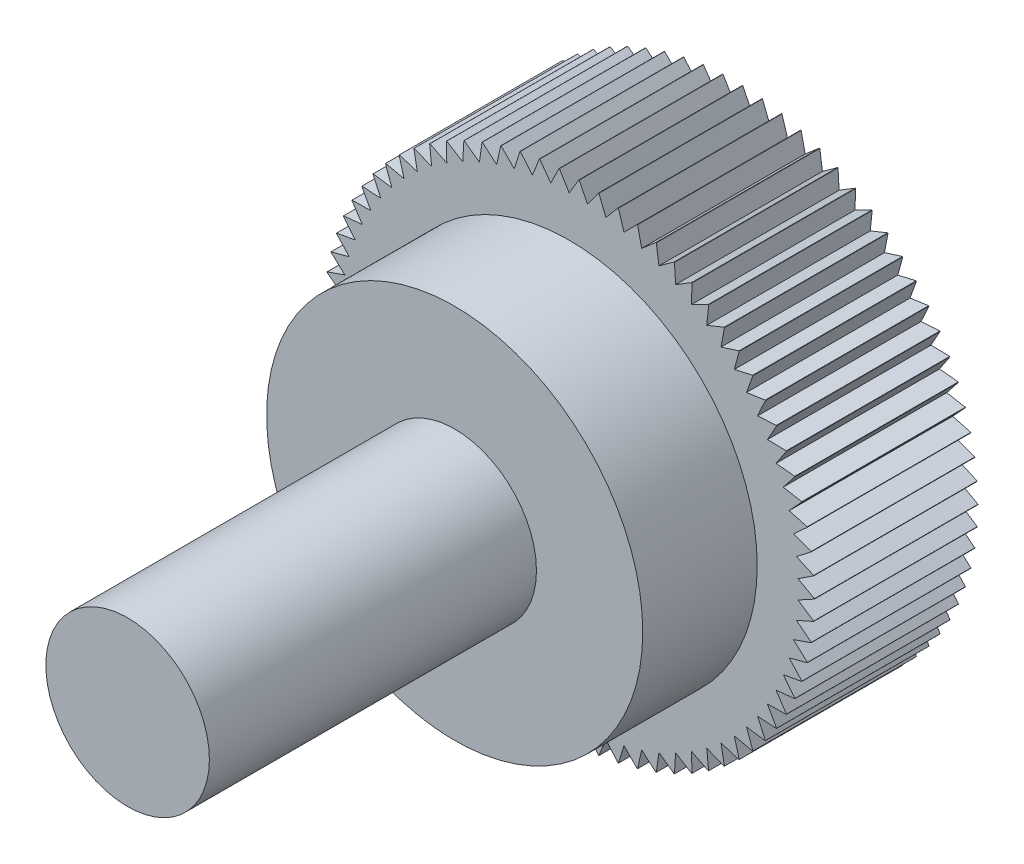
from build123d import *

# Parameters (mm, degrees)
SKETCH1_R          = 7.5
EXTRUDE1_DEPTH     = 5
SKETCH2_R          = 5.75
EXTRUDE2_DEPTH     = 3.5
SKETCH3_R          = 2.5
EXTRUDE3_DEPTH     = 10
CUT_EXTRUDE1_DEPTH = 20


with BuildPart() as part:
    # Sketch1 → Extrude1 (new body)
    with BuildSketch(Plane.XY):
        Circle(SKETCH1_R)
    extrude(amount=EXTRUDE1_DEPTH)

    # Sketch2 → Extrude2 (add)
    with BuildSketch(Plane.XY.offset(5)):
        Circle(SKETCH2_R)
    extrude(amount=EXTRUDE2_DEPTH)

    # Sketch3 → Extrude3 (add)
    with BuildSketch(Plane.XY.offset(8.5)):
        Circle(SKETCH3_R)
    extrude(amount=EXTRUDE3_DEPTH)

    # Sketch4 → Cut-Extrude1 (cut)
    with BuildSketch(Plane(origin=(0, 0, 0), x_dir=(-1, 0, 0), z_dir=(0, 0, -1))):
        Polygon((-0.3, 7.5), (0, 7), (0.3, 7.5), align=None)
        Polygon((0.304472073, 7.499819782), (0.563265981, 6.977301157), (0.902526458, 7.45153984), align=None)
        Polygon((0.906969528, 7.451000354), (1.122878966, 6.909351838), (1.499199685, 7.354753586), align=None)
        Polygon((1.503584937, 7.35385833), (1.67520965, 6.796592722), (2.086150027, 7.210268931), align=None)
        Polygon((2.090449021, 7.209023713), (2.216675957, 6.639755094), (2.659570886, 7.019022916), align=None)
        Polygon((2.663755741, 7.01743581), (2.743766269, 6.439856106), (3.215743407, 6.782255844), align=None)
        Polygon((3.219786983, 6.780337144), (3.253062204, 6.19819218), (3.751060598, 6.501503241), align=None)
        Polygon((3.75493667, 6.499265389), (3.741260783, 5.916330599), (4.262050722, 6.178585894), align=None)
        Polygon((4.265734153, 6.176043405), (4.20519585, 5.596099344), (4.745399811, 5.815598046), align=None)
        Polygon((4.748866712, 5.812767409), (4.641858608, 5.239575237), (5.197973161, 5.414893814), align=None)
        Polygon((5.201201049, 5.411793386), (5.048417131, 4.849070475), (5.616835661, 4.979071917), align=None)
        Polygon((5.619803601, 4.975721806), (5.422234733, 4.427117629), (5.999270826, 4.510958828), align=None)
        Polygon((6.00195957, 4.50738076), (5.760887061, 3.976453227), (6.342798418, 4.013590441), align=None)
        Polygon((6.345190528, 4.009807621), (6.062177826, 3.5), (6.645190528, 3.490192379), align=None)
        Polygon((6.647270491, 3.486229341), (6.324153042, 3.00084793), (6.904486028, 2.94415908), align=None)
        Polygon((6.906240354, 2.940041526), (6.545113699, 2.482234209), (7.119003286, 2.37903178), align=None)
        Polygon((7.120420598, 2.374786413), (6.723626781, 1.947522247), (7.287351076, 1.798475546), align=None)
        Polygon((7.288422182, 1.794129899), (6.858534564, 1.400179856), (7.408437598, 1.206255508), align=None)
        Polygon((7.409155552, 1.201837764), (6.948962119, 0.843756762), (7.48147756, 0.60621244), align=None)
        Polygon((7.481837704, 0.60175125), (6.994322987, 0.281861581), (7.505997268, 0.002237851), align=None)
        Polygon((7.505997268, -0.002237851), (6.994322987, -0.281861581), (7.481837704, -0.60175125), align=None)
        Polygon((7.48147756, -0.60621244), (6.948962119, -0.843756762), (7.409155552, -1.201837764), align=None)
        Polygon((7.408437598, -1.206255508), (6.858534564, -1.400179856), (7.288422182, -1.794129899), align=None)
        Polygon((7.287351076, -1.798475546), (6.723626781, -1.947522247), (7.120420598, -2.374786413), align=None)
        Polygon((7.119003286, -2.37903178), (6.545113699, -2.482234209), (6.906240354, -2.940041526), align=None)
        Polygon((6.904486028, -2.94415908), (6.324153042, -3.00084793), (6.647270491, -3.486229341), align=None)
        Polygon((6.645190528, -3.490192379), (6.062177826, -3.5), (6.345190528, -4.009807621), align=None)
        Polygon((6.342798418, -4.013590441), (5.760887061, -3.976453227), (6.00195957, -4.50738076), align=None)
        Polygon((5.999270826, -4.510958828), (5.422234733, -4.427117629), (5.619803601, -4.975721806), align=None)
        Polygon((5.616835661, -4.979071917), (5.048417131, -4.849070475), (5.201201049, -5.411793386), align=None)
        Polygon((5.197973161, -5.414893814), (4.641858608, -5.239575237), (4.748866712, -5.812767409), align=None)
        Polygon((4.745399811, -5.815598046), (4.20519585, -5.596099344), (4.265734153, -6.176043405), align=None)
        Polygon((4.262050722, -6.178585894), (3.741260783, -5.916330599), (3.75493667, -6.499265389), align=None)
        Polygon((3.751060598, -6.501503241), (3.253062204, -6.19819218), (3.219786983, -6.780337144), align=None)
        Polygon((3.215743407, -6.782255844), (2.743766269, -6.439856106), (2.663755741, -7.01743581), align=None)
        Polygon((2.659570886, -7.019022916), (2.216675957, -6.639755094), (2.090449021, -7.209023713), align=None)
        Polygon((2.086150027, -7.210268931), (1.67520965, -6.796592722), (1.503584937, -7.35385833), align=None)
        Polygon((1.499199685, -7.354753586), (1.122878966, -6.909351838), (0.906969528, -7.451000354), align=None)
        Polygon((0.902526458, -7.45153984), (0.563265981, -6.977301157), (0.304472073, -7.499819782), align=None)
        Polygon((0.3, -7.5), (0, -7), (-0.3, -7.5), align=None)
        Polygon((-0.304472073, -7.499819782), (-0.563265981, -6.977301157), (-0.902526458, -7.45153984), align=None)
        Polygon((-0.906969528, -7.451000354), (-1.122878966, -6.909351838), (-1.499199685, -7.354753586), align=None)
        Polygon((-1.503584937, -7.35385833), (-1.67520965, -6.796592722), (-2.086150027, -7.210268931), align=None)
        Polygon((-2.090449021, -7.209023713), (-2.216675957, -6.639755094), (-2.659570886, -7.019022916), align=None)
        Polygon((-2.663755741, -7.01743581), (-2.743766269, -6.439856106), (-3.215743407, -6.782255844), align=None)
        Polygon((-3.219786983, -6.780337144), (-3.253062204, -6.19819218), (-3.751060598, -6.501503241), align=None)
        Polygon((-3.75493667, -6.499265389), (-3.741260783, -5.916330599), (-4.262050722, -6.178585894), align=None)
        Polygon((-4.265734153, -6.176043405), (-4.20519585, -5.596099344), (-4.745399811, -5.815598046), align=None)
        Polygon((-4.748866712, -5.812767409), (-4.641858608, -5.239575237), (-5.197973161, -5.414893814), align=None)
        Polygon((-5.201201049, -5.411793386), (-5.048417131, -4.849070475), (-5.616835661, -4.979071917), align=None)
        Polygon((-5.619803601, -4.975721806), (-5.422234733, -4.427117629), (-5.999270826, -4.510958828), align=None)
        Polygon((-6.00195957, -4.50738076), (-5.760887061, -3.976453227), (-6.342798418, -4.013590441), align=None)
        Polygon((-6.345190528, -4.009807621), (-6.062177826, -3.5), (-6.645190528, -3.490192379), align=None)
        Polygon((-6.647270491, -3.486229341), (-6.324153042, -3.00084793), (-6.904486028, -2.94415908), align=None)
        Polygon((-6.906240354, -2.940041526), (-6.545113699, -2.482234209), (-7.119003286, -2.37903178), align=None)
        Polygon((-7.120420598, -2.374786413), (-6.723626781, -1.947522247), (-7.287351076, -1.798475546), align=None)
        Polygon((-7.288422182, -1.794129899), (-6.858534564, -1.400179856), (-7.408437598, -1.206255508), align=None)
        Polygon((-7.409155552, -1.201837764), (-6.948962119, -0.843756762), (-7.48147756, -0.60621244), align=None)
        Polygon((-7.481837704, -0.60175125), (-6.994322987, -0.281861581), (-7.505997268, -0.002237851), align=None)
        Polygon((-7.505997268, 0.002237851), (-6.994322987, 0.281861581), (-7.481837704, 0.60175125), align=None)
        Polygon((-7.48147756, 0.60621244), (-6.948962119, 0.843756762), (-7.409155552, 1.201837764), align=None)
        Polygon((-7.408437598, 1.206255508), (-6.858534564, 1.400179856), (-7.288422182, 1.794129899), align=None)
        Polygon((-7.287351076, 1.798475546), (-6.723626781, 1.947522247), (-7.120420598, 2.374786413), align=None)
        Polygon((-7.119003286, 2.37903178), (-6.545113699, 2.482234209), (-6.906240354, 2.940041526), align=None)
        Polygon((-6.904486028, 2.94415908), (-6.324153042, 3.00084793), (-6.647270491, 3.486229341), align=None)
        Polygon((-6.645190528, 3.490192379), (-6.062177826, 3.5), (-6.345190528, 4.009807621), align=None)
        Polygon((-6.342798418, 4.013590441), (-5.760887061, 3.976453227), (-6.00195957, 4.50738076), align=None)
        Polygon((-5.999270826, 4.510958828), (-5.422234733, 4.427117629), (-5.619803601, 4.975721806), align=None)
        Polygon((-5.616835661, 4.979071917), (-5.048417131, 4.849070475), (-5.201201049, 5.411793386), align=None)
        Polygon((-5.197973161, 5.414893814), (-4.641858608, 5.239575237), (-4.748866712, 5.812767409), align=None)
        Polygon((-4.745399811, 5.815598046), (-4.20519585, 5.596099344), (-4.265734153, 6.176043405), align=None)
        Polygon((-4.262050722, 6.178585894), (-3.741260783, 5.916330599), (-3.75493667, 6.499265389), align=None)
        Polygon((-3.751060598, 6.501503241), (-3.253062204, 6.19819218), (-3.219786983, 6.780337144), align=None)
        Polygon((-3.215743407, 6.782255844), (-2.743766269, 6.439856106), (-2.663755741, 7.01743581), align=None)
        Polygon((-2.659570886, 7.019022916), (-2.216675957, 6.639755094), (-2.090449021, 7.209023713), align=None)
        Polygon((-2.086150027, 7.210268931), (-1.67520965, 6.796592722), (-1.503584937, 7.35385833), align=None)
        Polygon((-1.499199685, 7.354753586), (-1.122878966, 6.909351838), (-0.906969528, 7.451000354), align=None)
        Polygon((-0.902526458, 7.45153984), (-0.563265981, 6.977301157), (-0.304472073, 7.499819782), align=None)
    extrude(amount=-CUT_EXTRUDE1_DEPTH, mode=Mode.SUBTRACT)


solid = part.part
